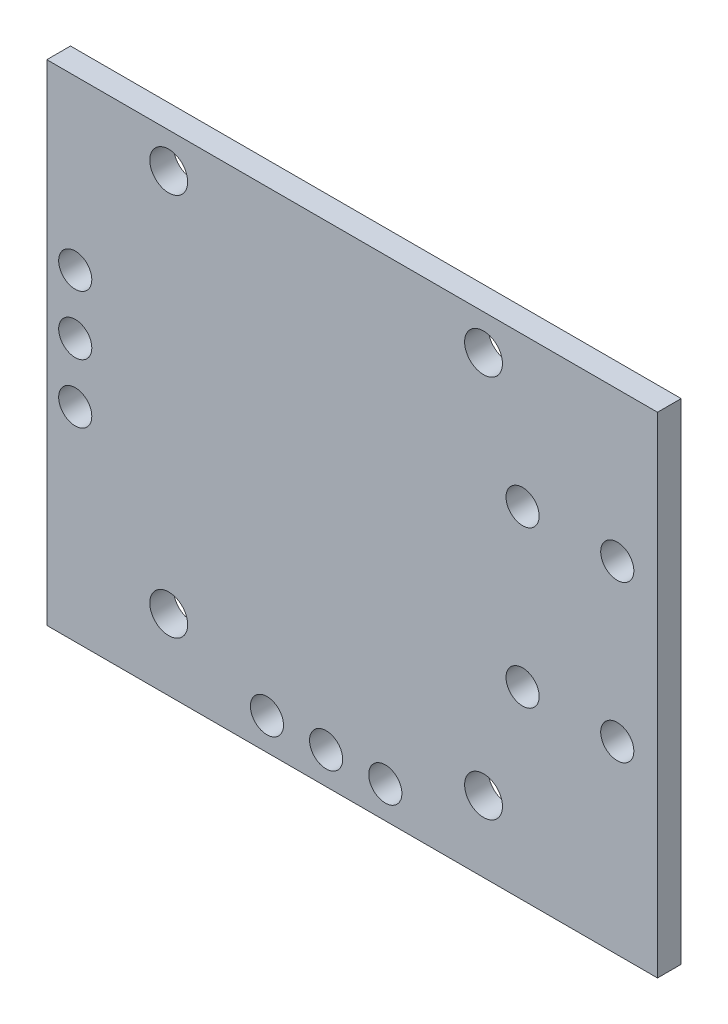
from build123d import *

# Parameters (mm, degrees)
SKETCH_1_W      = 25.8
SKETCH_1_H      = 20.7
SKETCH_1_R      = 0.7
SKETCH_1_R_2    = 0.8
EXTRUDE_1_DEPTH = 1


with BuildPart() as part:
    # ｽｹｯﾁ1 → ﾎﾞｽ - 押し出し1 (new body)
    with BuildSketch(Plane.XY):
        with Locations((12.9, -10.35)):
            Rectangle(SKETCH_1_W, SKETCH_1_H)
        with Locations((1.2, -7.1)):
            Circle(SKETCH_1_R, mode=Mode.SUBTRACT)
        with Locations((1.2, -9.6)):
            Circle(SKETCH_1_R, mode=Mode.SUBTRACT)
        with Locations((1.2, -12.1)):
            Circle(SKETCH_1_R, mode=Mode.SUBTRACT)
        with Locations((5.15, -17.7)):
            Circle(SKETCH_1_R_2, mode=Mode.SUBTRACT)
        with Locations((5.15, -1.5)):
            Circle(SKETCH_1_R_2, mode=Mode.SUBTRACT)
        with Locations((18.45, -1.5)):
            Circle(SKETCH_1_R_2, mode=Mode.SUBTRACT)
        with Locations((18.45, -17.7)):
            Circle(SKETCH_1_R_2, mode=Mode.SUBTRACT)
        with Locations((9.3, -19.35)):
            Circle(SKETCH_1_R, mode=Mode.SUBTRACT)
        with Locations((11.8, -19.35)):
            Circle(SKETCH_1_R, mode=Mode.SUBTRACT)
        with Locations((20.1, -6.3)):
            Circle(SKETCH_1_R, mode=Mode.SUBTRACT)
        with Locations((24.1, -6.3)):
            Circle(SKETCH_1_R, mode=Mode.SUBTRACT)
        with Locations((20.1, -12.9)):
            Circle(SKETCH_1_R, mode=Mode.SUBTRACT)
        with Locations((24.1, -12.9)):
            Circle(SKETCH_1_R, mode=Mode.SUBTRACT)
        with Locations((14.3, -19.35)):
            Circle(SKETCH_1_R, mode=Mode.SUBTRACT)
    extrude(amount=EXTRUDE_1_DEPTH)


solid = part.part
